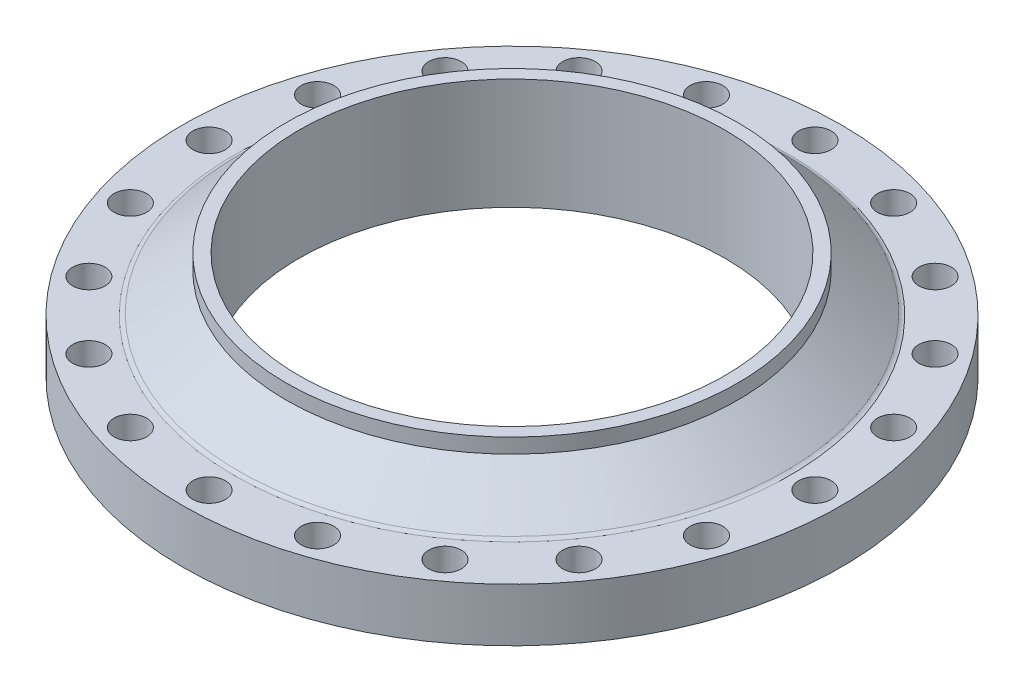
from build123d import *

# Parameters (mm, degrees)
SKETCH2_R          = 22
CUT_EXTRUDE2_DEPTH = 270


with BuildPart() as part:
    # Sketch1 → Revolve2 (revolve)
    with BuildSketch(Plane.XY, mode=Mode.PRIVATE) as revolve2_sk:
        with BuildLine():
            Line((445, 77), (375, 77))
            ThreePointArc((375, 77), (372.006131672, 77.84404461), (369.329788537, 79.429240589))
            Line((369.329788537, 79.429240589), (304.8, 130))
            Line((304.8, 130), (304.8, 150))
            Line((304.8, 150), (287.4, 150))
            Line((287.4, 150), (287.4, 0))
            Line((287.4, 0), (370, 0))
            Line((370, 0), (375, 5))
            Line((375, 5), (445, 5))
            Line((445, 5), (445, 77))
        make_face()
    revolve(revolve2_sk.sketch.rotate(Axis((0, 92.097125436, 0), (0, 1, 0)), 90), axis=Axis((0, 92.097125436, 0), (0, 1, 0)))

    # Sketch2 → Cut-Extrude2 (cut, symmetric)
    with BuildSketch(Plane(origin=(0, 0, 0), x_dir=(1, 0, 0), z_dir=(0, 1, 0))):
        with Locations(Location((409, 0, 0), (0, 0, 270))):
            Circle(SKETCH2_R)
        with Locations(Location((388.982115165, -126.387950699, 0), (0, 0, 270))):
            Circle(SKETCH2_R)
        with Locations(Location((330.887950699, -240.404168188, 0), (0, 0, 270))):
            Circle(SKETCH2_R)
        with Locations(Location((240.404168188, -330.887950699, 0), (0, 0, 270))):
            Circle(SKETCH2_R)
        with Locations(Location((126.387950699, -388.982115165, 0), (0, 0, 270))):
            Circle(SKETCH2_R)
        with Locations(Location((0, -409, 0), (0, 0, 270))):
            Circle(SKETCH2_R)
        with Locations(Location((-126.387950699, -388.982115165, 0), (0, 0, 270))):
            Circle(SKETCH2_R)
        with Locations(Location((-240.404168188, -330.887950699, 0), (0, 0, 270))):
            Circle(SKETCH2_R)
        with Locations(Location((-330.887950699, -240.404168188, 0), (0, 0, 270))):
            Circle(SKETCH2_R)
        with Locations(Location((-388.982115165, -126.387950699, 0), (0, 0, 270))):
            Circle(SKETCH2_R)
        with Locations(Location((-409, 0, 0), (0, 0, 270))):
            Circle(SKETCH2_R)
        with Locations(Location((-388.982115165, 126.387950699, 0), (0, 0, 270))):
            Circle(SKETCH2_R)
        with Locations(Location((-330.887950699, 240.404168188, 0), (0, 0, 270))):
            Circle(SKETCH2_R)
        with Locations(Location((-240.404168188, 330.887950699, 0), (0, 0, 270))):
            Circle(SKETCH2_R)
        with Locations(Location((-126.387950699, 388.982115165, 0), (0, 0, 270))):
            Circle(SKETCH2_R)
        with Locations(Location((0, 409, 0), (0, 0, 270))):
            Circle(SKETCH2_R)
        with Locations(Location((126.387950699, 388.982115165, 0), (0, 0, 270))):
            Circle(SKETCH2_R)
        with Locations(Location((240.404168188, 330.887950699, 0), (0, 0, 270))):
            Circle(SKETCH2_R)
        with Locations(Location((330.887950699, 240.404168188, 0), (0, 0, 270))):
            Circle(SKETCH2_R)
        with Locations(Location((388.982115165, 126.387950699, 0), (0, 0, 270))):
            Circle(SKETCH2_R)
    extrude(amount=CUT_EXTRUDE2_DEPTH, both=True, mode=Mode.SUBTRACT)


solid = part.part
